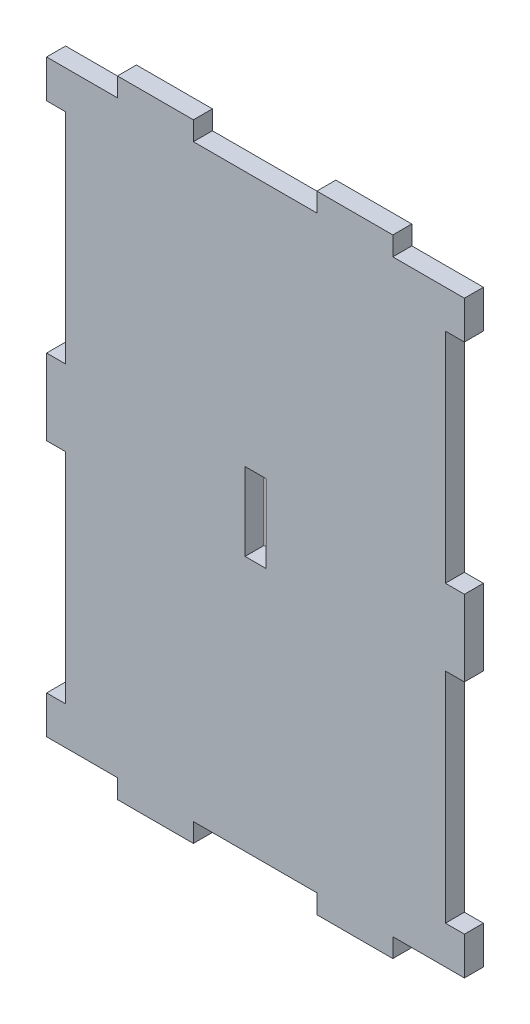
from build123d import *

# Parameters (mm, degrees)
SKETCH2_W           = 5.5
SKETCH2_H           = 20.5
BOSS_EXTRUDE1_DEPTH = 2.5


with BuildPart() as part:
    # Sketch2 → Boss-Extrude1 (new, symmetric)
    with BuildSketch(Plane.XY):
        Polygon((-627.802632857, -77.297008648), (-627.802632857, -72.297008648), (-647.802632857, -72.297008648), (-647.802632857, -77.297008648), (-666.454340614, -77.297008648), (-666.454340614, -87.297008648), (-661.454340614, -87.297008648), (-661.454340614, -144.797008648), (-666.454340614, -144.797008648), (-666.454340614, -164.797008648), (-661.454340614, -164.797008648), (-661.454340614, -222.297008648), (-666.454340614, -222.297008648), (-666.454340614, -232.297008648), (-647.802632857, -232.297008648), (-647.802632857, -237.297008648), (-627.802632857, -237.297008648), (-627.802632857, -232.297008648), (-595.302601942, -232.297008648), (-595.302601942, -237.297008648), (-575.302601942, -237.297008648), (-575.302601942, -232.297008648), (-556.454340614, -232.297008648), (-556.454340614, -222.297008648), (-561.454340614, -222.297008648), (-561.454340614, -164.797008648), (-556.454340614, -164.797008648), (-556.454340614, -144.797008648), (-561.454340614, -144.797008648), (-561.454340614, -87.297008648), (-556.454340614, -87.297008648), (-556.454340614, -77.297008648), (-575.302601942, -77.297008648), (-575.302601942, -72.297008648), (-595.302601942, -72.297008648), (-595.302601942, -77.297008648), align=None)
        with Locations((-611.454340614, -154.797008648)):
            Rectangle(SKETCH2_W, SKETCH2_H, mode=Mode.SUBTRACT)
    extrude(amount=BOSS_EXTRUDE1_DEPTH, both=True)


solid = part.part
